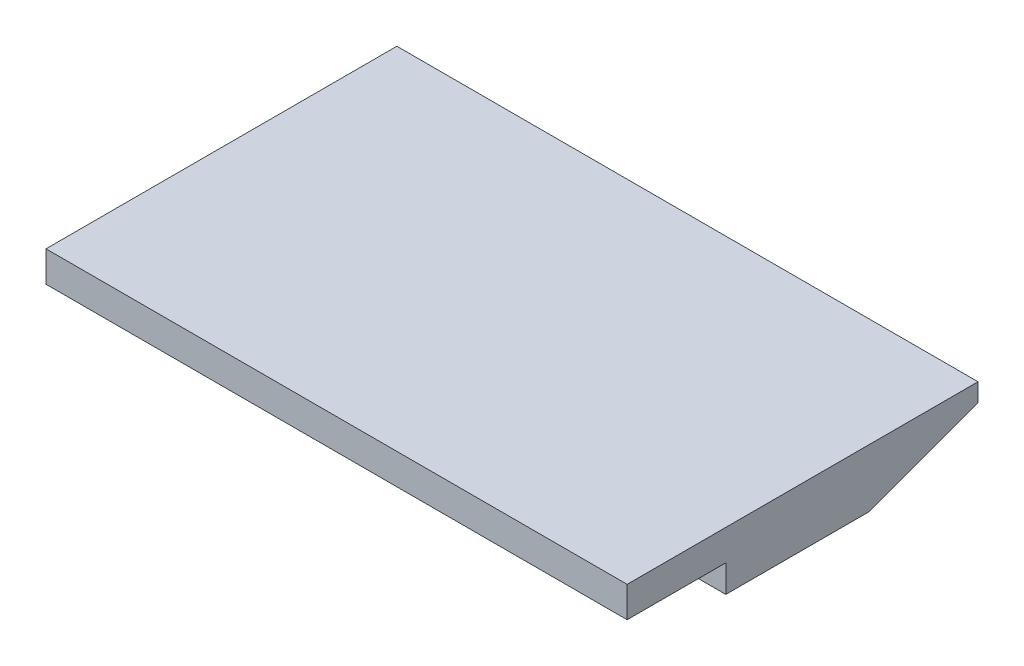
from build123d import *

# Parameters (mm, degrees)
SKIZZE1_W                       = 530
SKIZZE1_H                       = 320
AUFSATZ_LINEAR_AUSTRAGEN1_DEPTH = 53
FASE1_SIZE                      = 100
FASE1_SIZE2                     = 36.397023427
SKIZZE2_W                       = 90
SKIZZE2_H                       = 25
SCHNITT_LINEAR_AUSTRAGEN1_DEPTH = 530


with BuildPart() as part:
    # Skizze1 → Aufsatz-Linear austragen1 (new body)
    with BuildSketch(Plane(origin=(0, 0, 0), x_dir=(1, 0, 0), z_dir=(0, 1, 0))):
        Rectangle(SKIZZE1_W, SKIZZE1_H)
    extrude(amount=AUFSATZ_LINEAR_AUSTRAGEN1_DEPTH)

    # Fase1
    fase1_edges = [part.edges().sort_by_distance(p)[0] for p in [
        (0, 0, -160),
    ]]
    fase1_side = [part.faces().sort_by_distance(p)[0] for p in [
        (0, 0, 0),
    ]]
    chamfer(fase1_edges, length=FASE1_SIZE, length2=FASE1_SIZE2, reference=fase1_side[0])

    # Skizze2 → Schnitt-Linear austragen1 (cut)
    with BuildSketch(Plane(origin=(265, 0, 0), x_dir=(0, 0, -1), z_dir=(1, 0, 0))):
        with Locations((-115, 12.5)):
            Rectangle(SKIZZE2_W, SKIZZE2_H)
    extrude(amount=-SCHNITT_LINEAR_AUSTRAGEN1_DEPTH, mode=Mode.SUBTRACT)


solid = part.part
